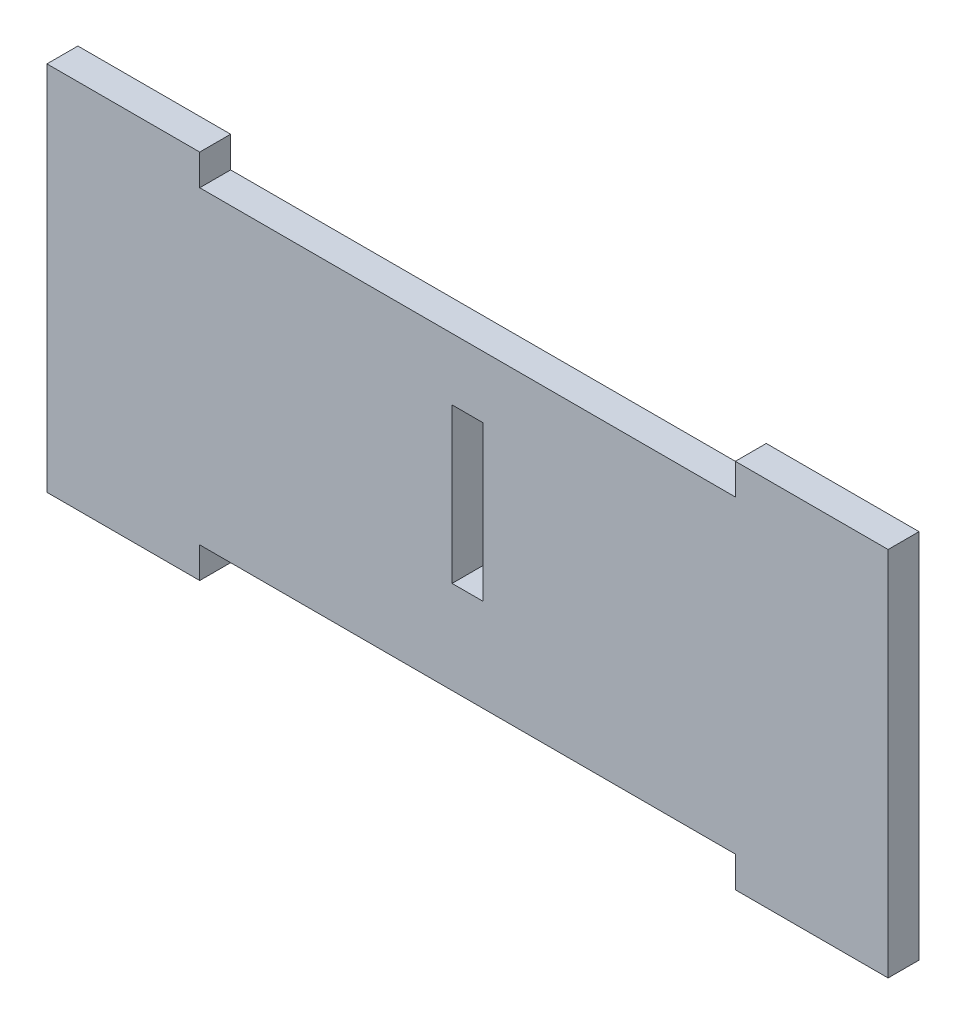
from build123d import *

# Parameters (mm, degrees)
SKETCH1_W           = 136
SKETCH1_H           = 50
BOSS_EXTRUDE1_DEPTH = 5
SKETCH2_W           = 24.7
SKETCH2_H           = 5
BOSS_EXTRUDE2_DEPTH = 5
SKETCH3_W           = 24.7
SKETCH3_H           = 5
BOSS_EXTRUDE3_DEPTH = 5
SKETCH4_W           = 5
SKETCH4_H           = 25
CUT_EXTRUDE1_DEPTH  = 5


with BuildPart() as part:
    # Sketch1 → Boss-Extrude1 (new body)
    with BuildSketch(Plane.XY):
        with Locations((0, 25)):
            Rectangle(SKETCH1_W, SKETCH1_H)
    extrude(amount=BOSS_EXTRUDE1_DEPTH)

    # Sketch2 → Boss-Extrude2 (add)
    with BuildSketch(Plane(origin=(0, 50, 0), x_dir=(1, 0, 0), z_dir=(0, 1, 0))):
        with Locations((-55.65, -2.5)):
            Rectangle(SKETCH2_W, SKETCH2_H)
        with Locations((55.65, -2.5)):
            Rectangle(SKETCH2_W, SKETCH2_H)
    extrude(amount=BOSS_EXTRUDE2_DEPTH)

    # Sketch3 → Boss-Extrude3 (add)
    with BuildSketch(Plane.XZ):
        with Locations((-55.65, 2.5)):
            Rectangle(SKETCH3_W, SKETCH3_H)
        with Locations((55.65, 2.5)):
            Rectangle(SKETCH3_W, SKETCH3_H)
    extrude(amount=BOSS_EXTRUDE3_DEPTH)

    # Sketch4 → Cut-Extrude1 (cut)
    with BuildSketch(Plane.XY.offset(5)):
        with Locations((0, 27.5)):
            Rectangle(SKETCH4_W, SKETCH4_H)
    extrude(amount=-CUT_EXTRUDE1_DEPTH, mode=Mode.SUBTRACT)


solid = part.part
